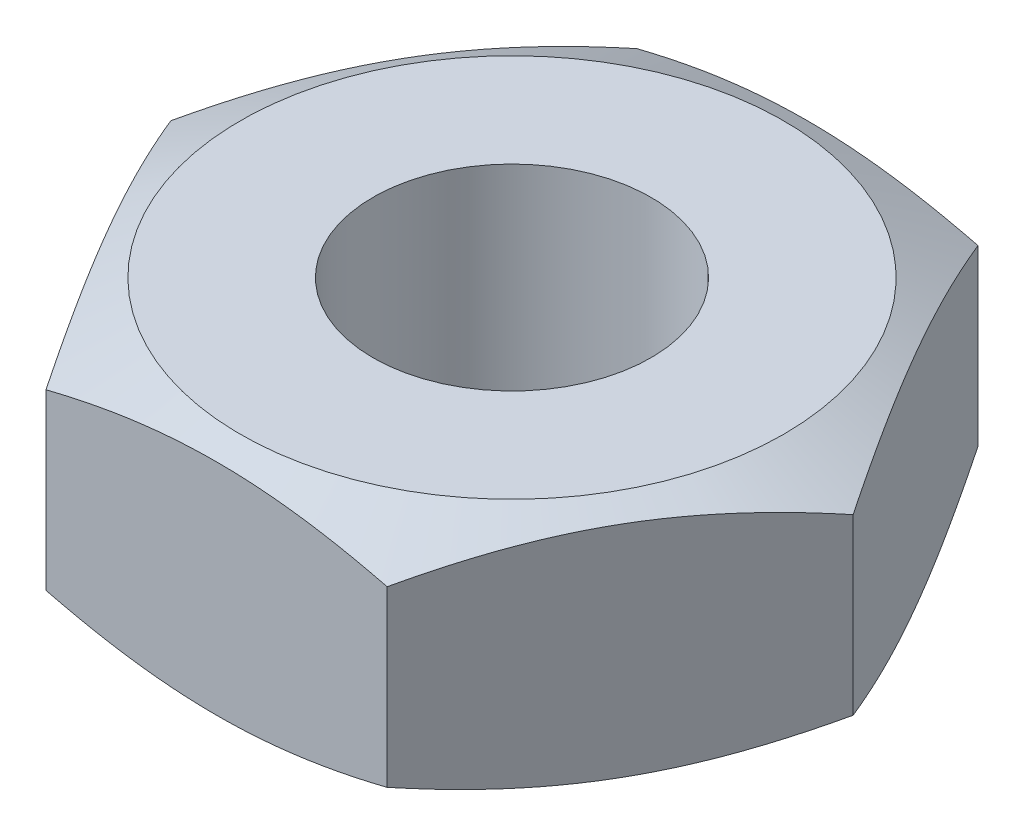
from build123d import *

# Parameters (mm, degrees)
SKETCH1_R           = 2
BOSS_EXTRUDE1_DEPTH = 3.5


with BuildPart() as part:
    # Sketch1 → Boss-Extrude1 (new body)
    with BuildSketch(Plane(origin=(0, 0, 0), x_dir=(1, 0, 0), z_dir=(0, 1, 0))):
        Polygon((2.453738644, 4.25), (-2.453738644, 4.25), (-4.907477288, 0), (-2.453738644, -4.25), (2.453738644, -4.25), (4.907477288, 0), align=None)
        with Locations(Location((0, 0, 0), (0, 0, 270))):
            Circle(SKETCH1_R, mode=Mode.SUBTRACT)
    extrude(amount=BOSS_EXTRUDE1_DEPTH)

    # Sketch2 → Cut-Revolve1 (revolve, cut)
    with BuildSketch(Plane.XY):
        Polygon((3.907477288, 3.5), (4.907477288, 3), (4.907477288, 3.5), align=None)
        Polygon((3.907477288, 0), (4.907477288, 0), (4.907477288, 0.5), align=None)
    revolve(axis=Axis((0, -1000, 0), (0, 1, 0)), mode=Mode.SUBTRACT)


solid = part.part
